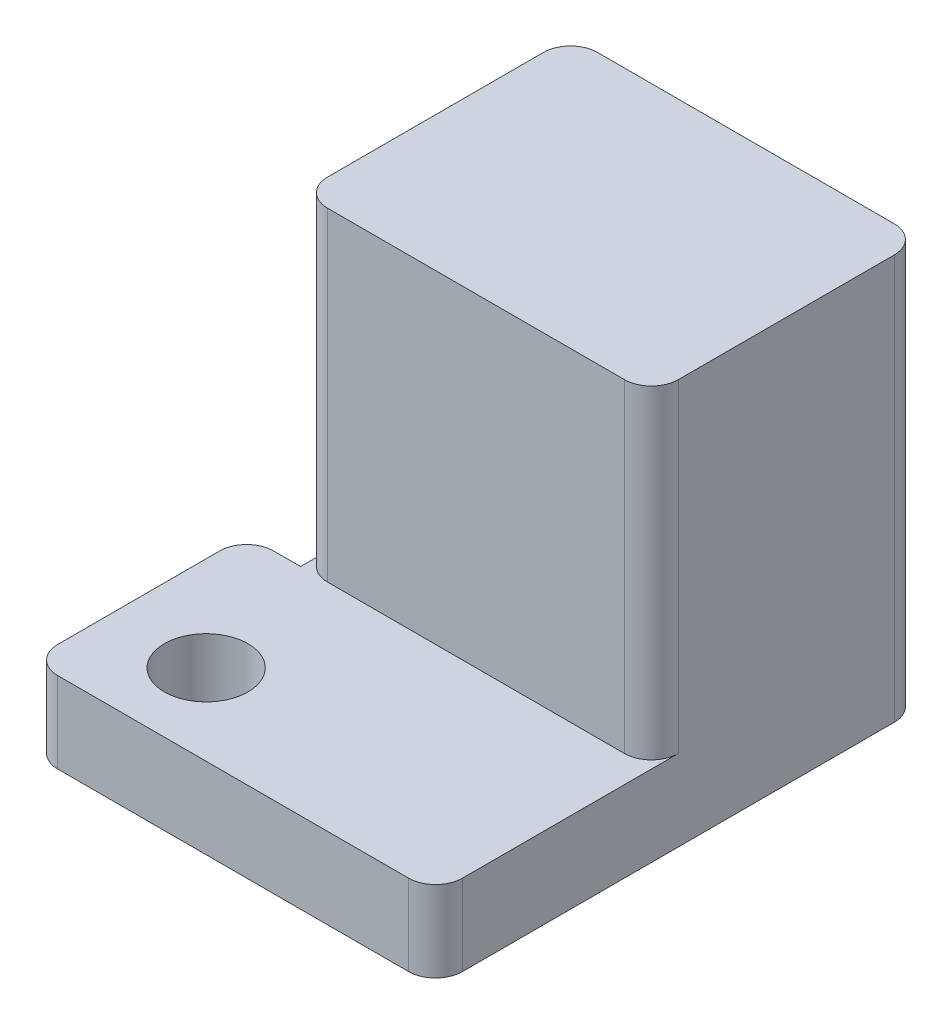
from build123d import *

# Parameters (mm, degrees)
CROQUIS1_W              = 18
CROQUIS1_H              = 18
CROQUIS1_R              = 1.55
SALIENTE_EXTRUIR1_DEPTH = 3
CROQUIS3_W              = 18
CROQUIS3_H              = 10
SALIENTE_EXTRUIR3_DEPTH = 3
CORTAR_EXTRUIR1_REACH   = 28.153
CROQUIS4_W              = 2
CROQUIS4_H              = 10
CROQUIS14_W             = 16
CROQUIS14_H             = 10
SALIENTE_EXTRUIR8_DEPTH = 9
CORTAR_EXTRUIR2_DEPTH   = 3
REDONDEO1_R             = 1


with BuildPart() as part:
    # Croquis1 → Saliente-Extruir1 (new body)
    with BuildSketch(Plane(origin=(0, 0, 0), x_dir=(1, 0, 0), z_dir=(0, 1, 0))):
        with Locations((9, 9)):
            Rectangle(CROQUIS1_W, CROQUIS1_H)
        with Locations(Location((3.5, 3, 0), (0, 0, 270))):
            Circle(CROQUIS1_R, mode=Mode.SUBTRACT)
    extrude(amount=SALIENTE_EXTRUIR1_DEPTH)

    # Croquis3 → Saliente-Extruir3 (add)
    with BuildSketch(Plane(origin=(0, 3, 0), x_dir=(1, 0, 0), z_dir=(0, 1, 0))):
        with Locations((9, 13)):
            Rectangle(CROQUIS3_W, CROQUIS3_H)
    extrude(amount=SALIENTE_EXTRUIR3_DEPTH)

    # Cortar-Extruir1: up to this face of the body (flat: up to its plane)
    cortar_extruir1_end = Plane(part.part.faces().sort_by_distance((9, 6, -13))[0])
    # Croquis4 → Cortar-Extruir1 (cut, up to the picked face)
    with BuildSketch(Plane.XZ, mode=Mode.PRIVATE) as cortar_extruir1_sk1:
        with Locations((1, -13)):
            Rectangle(CROQUIS4_W, CROQUIS4_H)
    cortar_extruir1_tool1 = split(extrude(cortar_extruir1_sk1.sketch, amount=-CORTAR_EXTRUIR1_REACH, mode=Mode.PRIVATE), bisect_by=cortar_extruir1_end, keep=Keep.BOTH, mode=Mode.PRIVATE)
    add(cortar_extruir1_tool1.solids().sort_by(Axis((1, 0, -13), (0, 1, 0)))[0], mode=Mode.SUBTRACT)

    # Croquis14 → Saliente-Extruir8 (add)
    with BuildSketch(Plane(origin=(0, 6, 0), x_dir=(1, 0, 0), z_dir=(0, 1, 0))):
        with Locations((10, 13)):
            Rectangle(CROQUIS14_W, CROQUIS14_H)
    extrude(amount=SALIENTE_EXTRUIR8_DEPTH)

    # Croquis15 → Cortar-Extruir2 (cut)
    with BuildSketch(Plane(origin=(18, 0, 0), x_dir=(0, 0, -1), z_dir=(1, 0, 0))):
        Polygon((0, 0), (18, 0), (18, 15), (8, 15), (8, 3), (0, 3), align=None)
    extrude(amount=-CORTAR_EXTRUIR2_DEPTH, mode=Mode.SUBTRACT)

    # Redondeo1
    redondeo1_edges = [part.edges().sort_by_distance(p)[0] for p in [
        (0, 1.5, -8),
        (2, 7.5, -18),
        (2, 9, -8),
        (15, 1.5, 0),
        (15, 9, -8),
        (15, 7.5, -18),
        (0, 1.5, 0),
    ]]
    fillet(redondeo1_edges, radius=REDONDEO1_R)


solid = part.part
